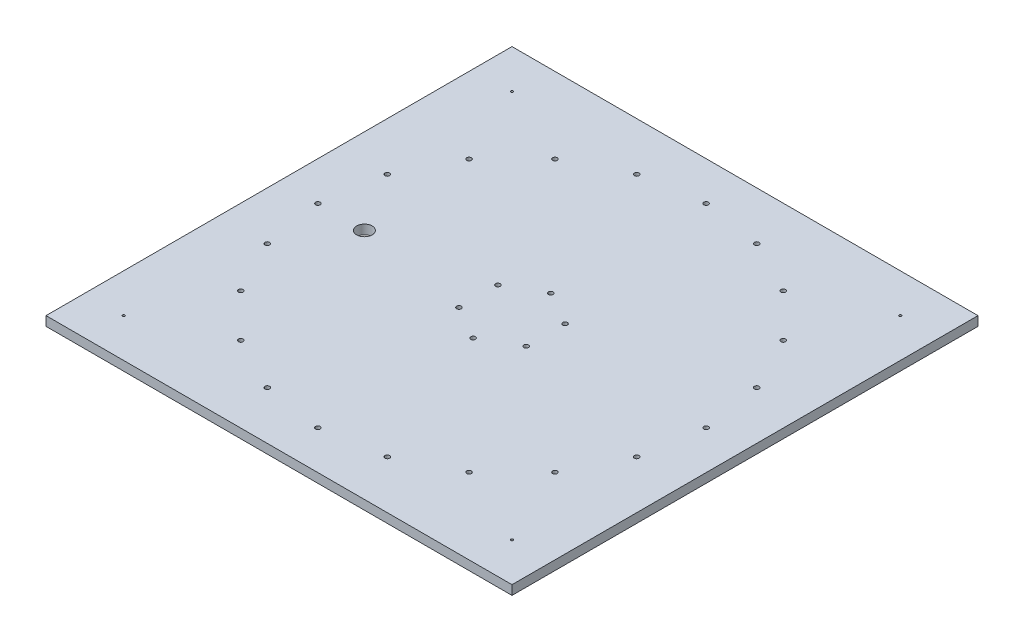
from build123d import *

# Parameters (mm, degrees)
SKETCH1_W           = 600
SKETCH1_H           = 600
SKETCH1_R           = 3
SKETCH1_R_2         = 1.5
SKETCH1_R_3         = 10
BOSS_EXTRUDE1_DEPTH = 12


with BuildPart() as part:
    # Sketch1 → Boss-Extrude1 (new body)
    with BuildSketch(Plane(origin=(0, 0, 0), x_dir=(1, 0, 0), z_dir=(0, 1, 0))):
        Rectangle(SKETCH1_W, SKETCH1_H)
        with Locations(Location((0, 250, 0), (0, 0, 270))):
            Circle(SKETCH1_R, mode=Mode.SUBTRACT)
        with Locations(Location((77.254248594, 237.764129074, 0), (0, 0, 270))):
            Circle(SKETCH1_R, mode=Mode.SUBTRACT)
        with Locations(Location((146.946313073, 202.254248594, 0), (0, 0, 270))):
            Circle(SKETCH1_R, mode=Mode.SUBTRACT)
        with Locations(Location((202.254248594, 146.946313073, 0), (0, 0, 270))):
            Circle(SKETCH1_R, mode=Mode.SUBTRACT)
        with Locations(Location((237.764129074, 77.254248594, 0), (0, 0, 270))):
            Circle(SKETCH1_R, mode=Mode.SUBTRACT)
        with Locations(Location((250, 0, 0), (0, 0, 270))):
            Circle(SKETCH1_R, mode=Mode.SUBTRACT)
        with Locations(Location((237.764129074, -77.254248594, 0), (0, 0, 270))):
            Circle(SKETCH1_R, mode=Mode.SUBTRACT)
        with Locations(Location((202.254248594, -146.946313073, 0), (0, 0, 270))):
            Circle(SKETCH1_R, mode=Mode.SUBTRACT)
        with Locations(Location((146.946313073, -202.254248594, 0), (0, 0, 270))):
            Circle(SKETCH1_R, mode=Mode.SUBTRACT)
        with Locations(Location((77.254248594, -237.764129074, 0), (0, 0, 270))):
            Circle(SKETCH1_R, mode=Mode.SUBTRACT)
        with Locations(Location((0, -250, 0), (0, 0, 270))):
            Circle(SKETCH1_R, mode=Mode.SUBTRACT)
        with Locations(Location((-77.254248594, -237.764129074, 0), (0, 0, 270))):
            Circle(SKETCH1_R, mode=Mode.SUBTRACT)
        with Locations(Location((-146.946313073, -202.254248594, 0), (0, 0, 270))):
            Circle(SKETCH1_R, mode=Mode.SUBTRACT)
        with Locations(Location((-202.254248594, -146.946313073, 0), (0, 0, 270))):
            Circle(SKETCH1_R, mode=Mode.SUBTRACT)
        with Locations(Location((-237.764129074, -77.254248594, 0), (0, 0, 270))):
            Circle(SKETCH1_R, mode=Mode.SUBTRACT)
        with Locations(Location((-250, 0, 0), (0, 0, 270))):
            Circle(SKETCH1_R, mode=Mode.SUBTRACT)
        with Locations(Location((-237.764129074, 77.254248594, 0), (0, 0, 270))):
            Circle(SKETCH1_R, mode=Mode.SUBTRACT)
        with Locations(Location((-202.254248594, 146.946313073, 0), (0, 0, 270))):
            Circle(SKETCH1_R, mode=Mode.SUBTRACT)
        with Locations(Location((-146.946313073, 202.254248594, 0), (0, 0, 270))):
            Circle(SKETCH1_R, mode=Mode.SUBTRACT)
        with Locations(Location((-77.254248594, 237.764129074, 0), (0, 0, 270))):
            Circle(SKETCH1_R, mode=Mode.SUBTRACT)
        with Locations(Location((0, 50, 0), (0, 0, 270))):
            Circle(SKETCH1_R, mode=Mode.SUBTRACT)
        with Locations(Location((43.301270189, 25, 0), (0, 0, 270))):
            Circle(SKETCH1_R, mode=Mode.SUBTRACT)
        with Locations(Location((43.301270189, -25, 0), (0, 0, 270))):
            Circle(SKETCH1_R, mode=Mode.SUBTRACT)
        with Locations(Location((0, -50, 0), (0, 0, 270))):
            Circle(SKETCH1_R, mode=Mode.SUBTRACT)
        with Locations(Location((-43.301270189, -25, 0), (0, 0, 270))):
            Circle(SKETCH1_R, mode=Mode.SUBTRACT)
        with Locations(Location((-43.301270189, 25, 0), (0, 0, 270))):
            Circle(SKETCH1_R, mode=Mode.SUBTRACT)
        with Locations(Location((-250, 250, 0), (0, 0, 270))):
            Circle(SKETCH1_R_2, mode=Mode.SUBTRACT)
        with Locations(Location((-190, 0, 0), (0, 0, 270))):
            Circle(SKETCH1_R_3, mode=Mode.SUBTRACT)
        with Locations(Location((250, 250, 0), (0, 0, 270))):
            Circle(SKETCH1_R_2, mode=Mode.SUBTRACT)
        with Locations(Location((250, -250, 0), (0, 0, 270))):
            Circle(SKETCH1_R_2, mode=Mode.SUBTRACT)
        with Locations(Location((-250, -250, 0), (0, 0, 270))):
            Circle(SKETCH1_R_2, mode=Mode.SUBTRACT)
    extrude(amount=BOSS_EXTRUDE1_DEPTH)


solid = part.part
